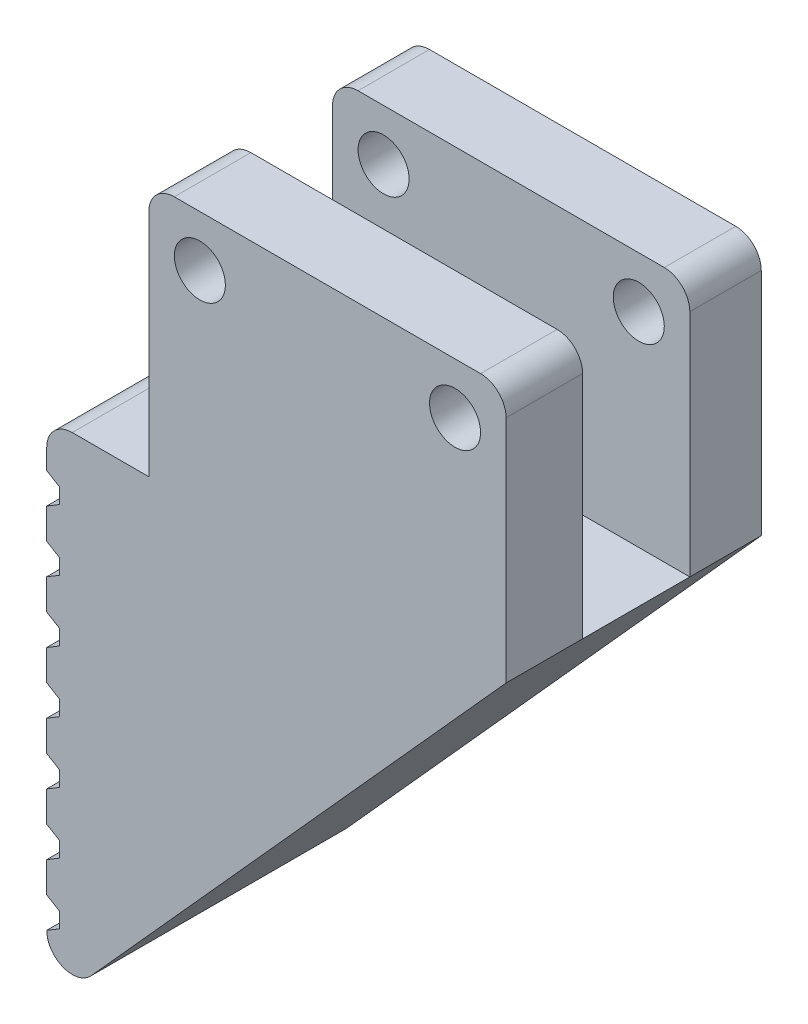
from build123d import *

# Parameters (mm, degrees)
SKETCH_1_W             = 14
SKETCH_1_H             = 10
EXTRUDE_1_DEPTH        = 10
SKETCH_2_R             = 1
CUT_EXTRUDE_1_DEPTH    = 10
SKETCH_3_W             = 14
SKETCH_3_H             = 4.2
CUT_EXTRUDE_2_DEPTH    = 10
FILLET_1_R             = 1
CUT_EXTRUDE_START      = -10
CUT_EXTRUDE_3_DEPTH    = 38.71788575
PATTERN_LINEAR_1_COUNT = 7
PATTERN_LINEAR_1_PITCH = 2.4
FILLET_2_R             = 1


with BuildPart() as part:
    # 草图1 → 凸台-拉伸1 (new body)
    with BuildSketch(Plane.XY):
        Rectangle(SKETCH_1_W, SKETCH_1_H)
        Polygon((-11, -5), (-7, -5), (7, -5), (-11, -25), align=None)
    extrude(amount=EXTRUDE_1_DEPTH)

    # 草图2 → 切除-拉伸1 (cut)
    with BuildSketch(Plane.XY.offset(10)):
        with Locations((-5, 3)):
            Circle(SKETCH_2_R)
        with Locations((5, 3)):
            Circle(SKETCH_2_R)
    extrude(amount=-CUT_EXTRUDE_1_DEPTH, mode=Mode.SUBTRACT)

    # 草图3 → 切除-拉伸2 (cut)
    with BuildSketch(Plane(origin=(0, 5, 0), x_dir=(1, 0, 0), z_dir=(0, 1, 0))):
        with Locations((0, -4.9)):
            Rectangle(SKETCH_3_W, SKETCH_3_H)
    extrude(amount=-CUT_EXTRUDE_2_DEPTH, mode=Mode.SUBTRACT)

    # 圆角1
    fillet_1_edges = [part.edges().sort_by_distance(p)[0] for p in [
        (-11, -25, 5),
        (-11, -5, 5),
    ]]
    fillet(fillet_1_edges, radius=FILLET_1_R)

    # 草图5 → 切除-拉伸3 (cut)
    with BuildSketch(Plane.XY.offset(10).offset(CUT_EXTRUDE_START)):
        Polygon((-75.789683565, -61.267851911), (-11, -22.394041773), (-10.5, -22.094041773), (-10.5, -21.494041773), (-11, -21.194041773), (-75.789683565, 17.679768366), (-226.903894824, 17.679768366), (-226.903894824, -61.267851911), align=None)
    cut_extrude_3 = extrude(amount=CUT_EXTRUDE_3_DEPTH, mode=Mode.SUBTRACT)

    # 阵列(线性)1: 切除-拉伸3 ×7
    with Locations(*[(0, i * PATTERN_LINEAR_1_PITCH, 0) for i in range(1, PATTERN_LINEAR_1_COUNT)]):
        add(cut_extrude_3, mode=Mode.SUBTRACT)

    # 圆角2
    fillet_2_edges = [part.edges().sort_by_distance(p)[0] for p in [
        (-7, 5, 8.5),
        (7, 5, 8.5),
        (-7, 5, 1.4),
        (7, 5, 1.4),
    ]]
    fillet(fillet_2_edges, radius=FILLET_2_R)


solid = part.part
